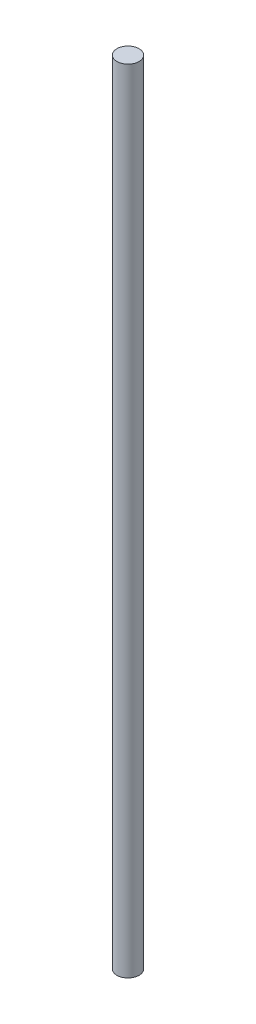
from build123d import *

# Parameters (mm, degrees)
SKETCH_1_R      = 4
EXTRUDE_1_DEPTH = 285


with BuildPart() as part:
    # 草图1 → 凸台-拉伸1 (new body)
    with BuildSketch(Plane(origin=(0, 0, 0), x_dir=(1, 0, 0), z_dir=(0, 1, 0))):
        with Locations(Location((0, 0, 0), (0, 0, 270))):
            Circle(SKETCH_1_R)
    extrude(amount=EXTRUDE_1_DEPTH)


solid = part.part
